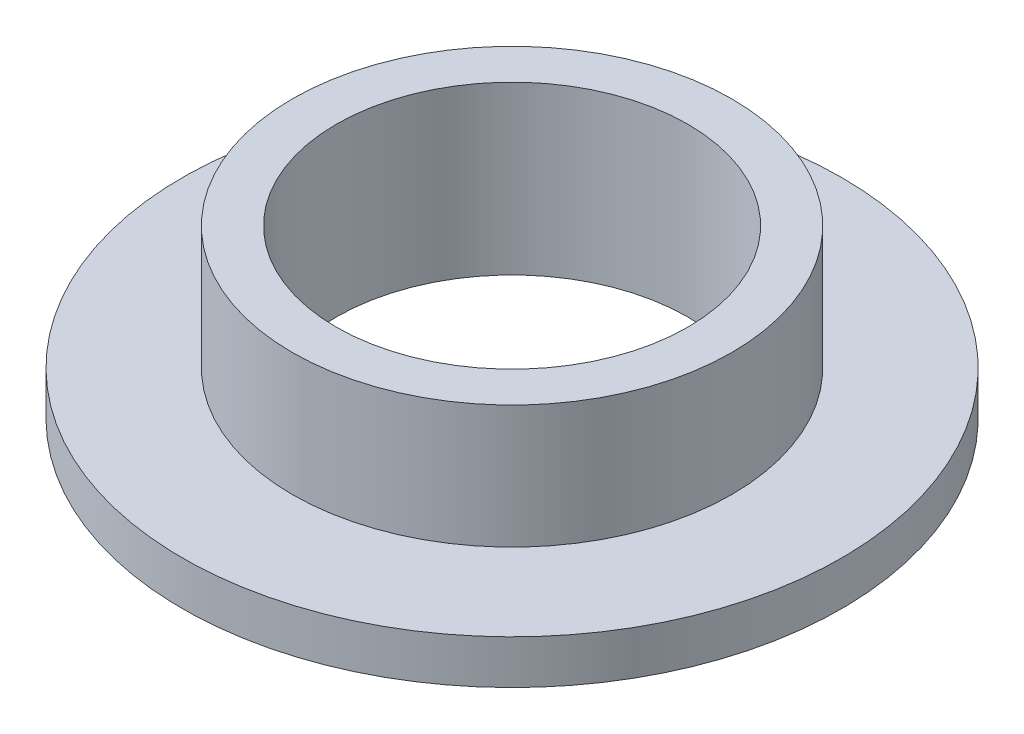
from build123d import *


with BuildPart() as part:
    # Croquis1 → Revolución1 (revolve)
    with BuildSketch(Plane.XY, mode=Mode.PRIVATE) as revoluci_n1_sk:
        Polygon((-4, 3.8), (-4, 0), (-7.5, 0), (-7.5, 1), (-5, 1), (-5, 3.8), align=None)
    revolve(revoluci_n1_sk.sketch.rotate(Axis((0, 0, 0), (0, 1, 0)), 270), axis=Axis((0, 0, 0), (0, 1, 0)))


solid = part.part
